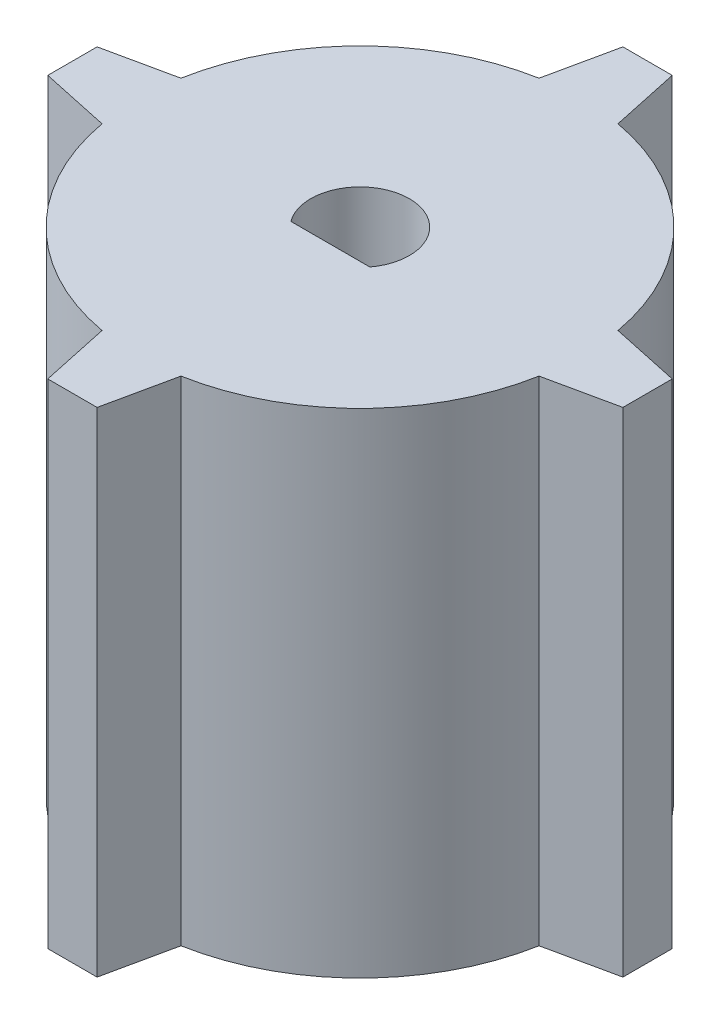
from build123d import *

# Parameters (mm, degrees)
BOSS_EXTRUDE1_DEPTH = 25.4


with BuildPart() as part:
    # Sketch1 → Boss-Extrude1 (new body)
    with BuildSketch(Plane(origin=(0, 0, 0), x_dir=(1, 0, 0), z_dir=(0, 1, 0))):
        with BuildLine():
            Line((-2.032, 11.247927631), (-1.27, 14.803927631))
            Line((-1.27, 14.803927631), (1.27, 14.803927631))
            Line((1.27, 14.803927631), (2.032, 11.247927631))
            ThreePointArc((2.032, 11.247927631), (8.082230509, 8.082230509), (11.247927631, 2.032))
            Line((11.247927631, 2.032), (14.803927631, 1.27))
            Line((14.803927631, 1.27), (14.803927631, -1.27))
            Line((14.803927631, -1.27), (11.247927631, -2.032))
            ThreePointArc((11.247927631, -2.032), (8.082230509, -8.082230509), (2.032, -11.247927631))
            Line((2.032, -11.247927631), (1.27, -14.803927631))
            Line((1.27, -14.803927631), (-1.27, -14.803927631))
            Line((-1.27, -14.803927631), (-2.032, -11.247927631))
            ThreePointArc((-2.032, -11.247927631), (-8.082230509, -8.082230509), (-11.247927631, -2.032))
            Line((-11.247927631, -2.032), (-14.803927631, -1.27))
            Line((-14.803927631, -1.27), (-14.803927631, 1.27))
            Line((-14.803927631, 1.27), (-11.247927631, 2.032))
            ThreePointArc((-11.247927631, 2.032), (-8.082230509, 8.082230509), (-2.032, 11.247927631))
        make_face()
        with BuildLine():
            Line((-2.032, -1.524), (2.032, -1.524))
            ThreePointArc((2.032, -1.524), (0, 2.54), (-2.032, -1.524))
        make_face(mode=Mode.SUBTRACT)
    extrude(amount=BOSS_EXTRUDE1_DEPTH)


solid = part.part
